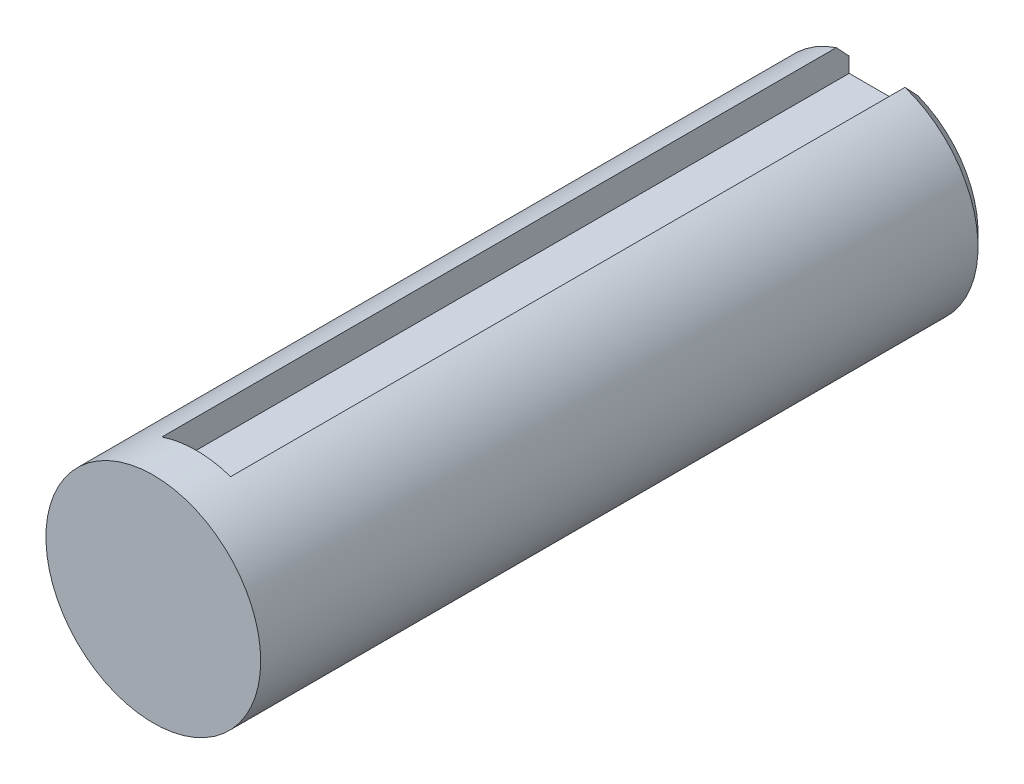
from build123d import *

# Parameters (mm, degrees)
SKETCH1_R           = 12.5
BOSS_EXTRUDE1_DEPTH = 85
SKETCH2_W           = 8
SKETCH2_H           = 8
CUT_EXTRUDE1_DEPTH  = 80
CHAMFER1_SIZE       = 1.5


with BuildPart() as part:
    # Sketch1 → Boss-Extrude1 (new body)
    with BuildSketch(Plane.XY):
        Circle(SKETCH1_R)
    extrude(amount=BOSS_EXTRUDE1_DEPTH)

    # Sketch2 → Cut-Extrude1 (cut)
    with BuildSketch(Plane(origin=(0, 0, 0), x_dir=(-1, 0, 0), z_dir=(0, 0, -1))):
        with Locations((0, 12.5)):
            Rectangle(SKETCH2_W, SKETCH2_H)
    extrude(amount=-CUT_EXTRUDE1_DEPTH, mode=Mode.SUBTRACT)

    # Chamfer1
    chamfer1_edges = [part.edges().sort_by_distance(p)[0] for p in [
        (-7.288689869, -10.155048006, 0),
    ]]
    chamfer(chamfer1_edges, length=CHAMFER1_SIZE)


solid = part.part
